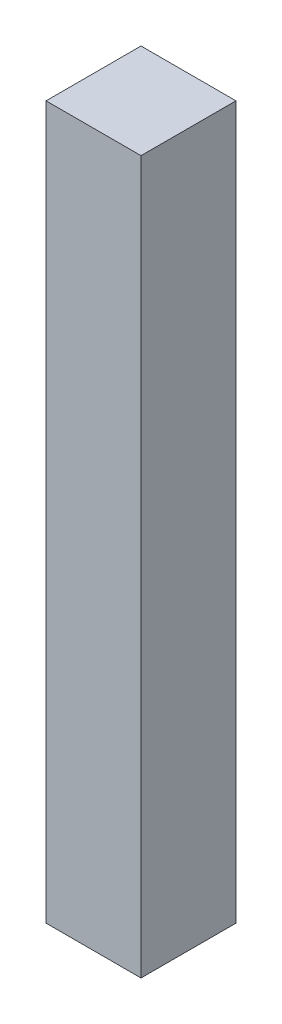
from build123d import *

# Parameters (mm, degrees)
SKETCH_1_W      = 20
SKETCH_1_H      = 20
EXTRUDE_1_DEPTH = 75


with BuildPart() as part:
    # Эскиз1 → Бобышка-Вытянуть1 (new, symmetric)
    with BuildSketch(Plane(origin=(0, 0, 0), x_dir=(1, 0, 0), z_dir=(0, 1, 0))):
        Rectangle(SKETCH_1_W, SKETCH_1_H)
    extrude(amount=EXTRUDE_1_DEPTH, both=True)


solid = part.part
